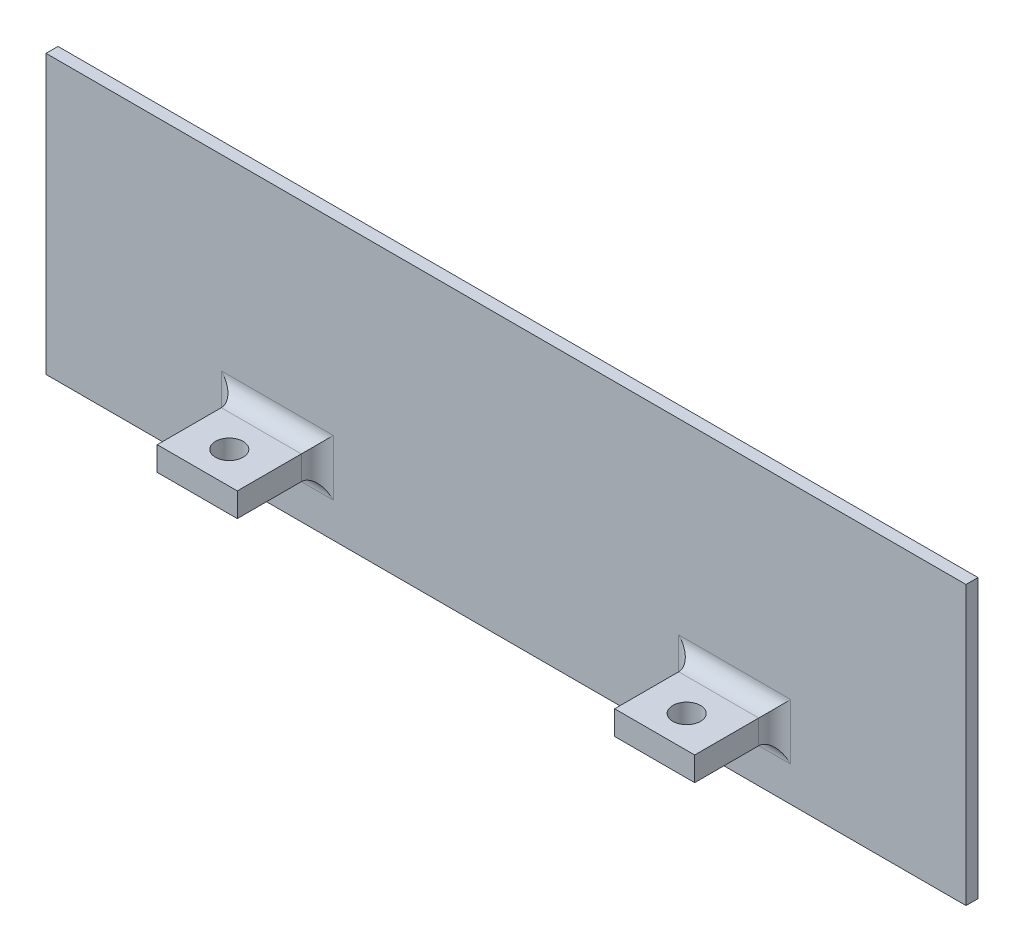
from build123d import *

# Parameters (mm, degrees)
SKETCH1_W             = 114.95
SKETCH1_H             = 34.75
REARPANEL_DEPTH       = 1.5
SKETCH2_W             = 10
SKETCH2_H             = 3
SCREWMOUNTS_DEPTH     = 10
FILLET1_R             = 2
F_4_CLEARANCE_HOLE1_D = 3.4544


with BuildPart() as part:
    # Sketch1 → RearPanel (new body)
    with BuildSketch(Plane.XY):
        with Locations((0, 4.383882718)):
            Rectangle(SKETCH1_W, SKETCH1_H)
    extrude(amount=REARPANEL_DEPTH)

    # Sketch2 → ScrewMounts (add)
    with BuildSketch(Plane.XY.offset(1.5)):
        with Locations((28.575, -5.141117282)):
            Rectangle(SKETCH2_W, SKETCH2_H)
        with Locations((-28.575, -5.141117282)):
            Rectangle(SKETCH2_W, SKETCH2_H)
    extrude(amount=SCREWMOUNTS_DEPTH)

    # Fillet1
    fillet1_edges = [part.edges().sort_by_distance(p)[0] for p in [
        (-28.575, -3.641117282, 1.5),
        (23.575, -5.141117282, 1.5),
        (28.575, -3.641117282, 1.5),
        (33.575, -5.141117282, 1.5),
        (28.575, -6.641117282, 1.5),
        (-23.575, -5.141117282, 1.5),
        (-33.575, -5.141117282, 1.5),
        (-28.575, -6.641117282, 1.5),
    ]]
    fillet(fillet1_edges, radius=FILLET1_R)

    # #4 Clearance Hole1 (through all)
    with Locations(Plane(origin=(0, -3.641117282, 0), x_dir=(1, 0, 0), z_dir=(0, 1, 0))):
        with Locations((28.575, -7.5), (-28.575, -7.5)):
            Hole(F_4_CLEARANCE_HOLE1_D / 2)


solid = part.part
